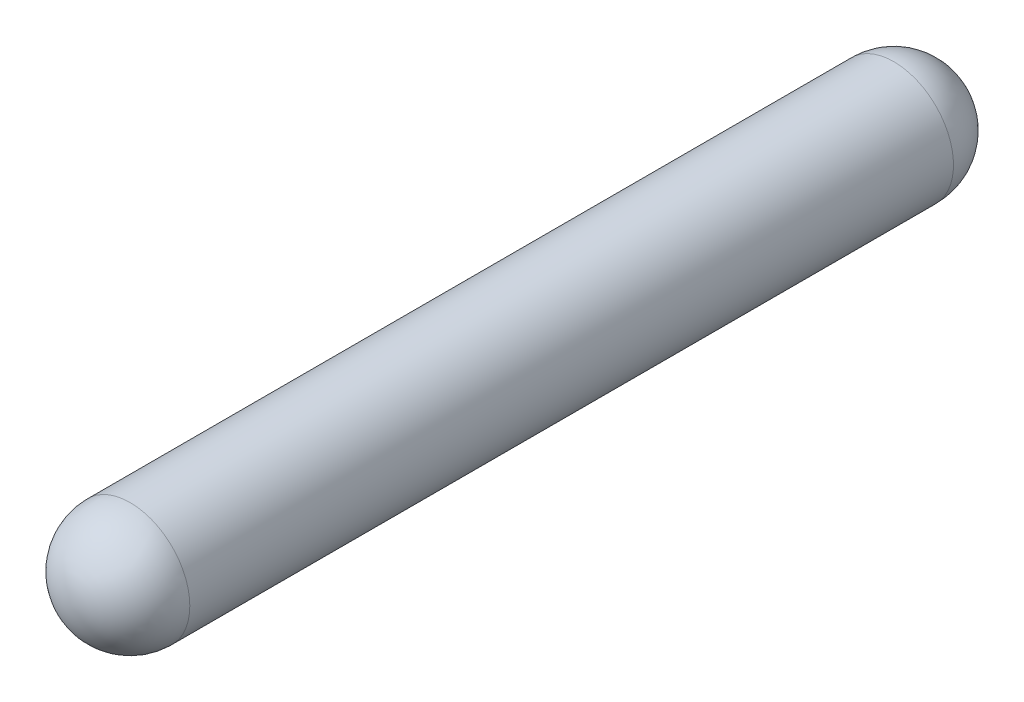
from build123d import *


with BuildPart() as part:
    # Çizim1 → Döndür1 (revolve)
    with BuildSketch(Plane.XZ, mode=Mode.PRIVATE) as d_nd_r1_sk:
        with BuildLine():
            Line((0, 37), (0, 0))
            ThreePointArc((0, 0), (1.767766953, 0.732233047), (2.5, 2.5))
            Line((2.5, 2.5), (2.5, 34.5))
            ThreePointArc((2.5, 34.5), (1.767766953, 36.267766953), (0, 37))
        make_face()
    revolve(d_nd_r1_sk.sketch.rotate(Axis((0, 0, 37), (0, 0, -1)), 180), axis=Axis((0, 0, 37), (0, 0, -1)))


solid = part.part
